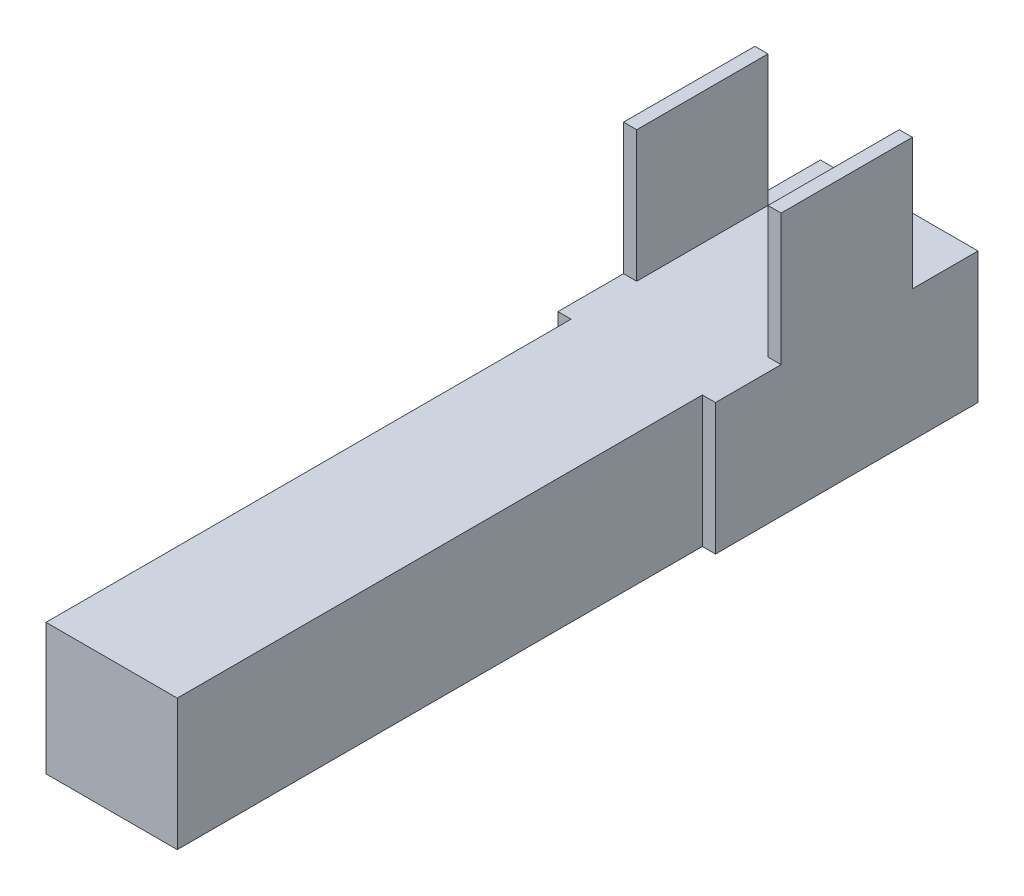
from build123d import *

# Parameters (mm, degrees)
SKETCH1_W           = 12.7
SKETCH1_H           = 152.4
BOSS_EXTRUDE1_DEPTH = 25.4
SKETCH6_W           = 50.8
SKETCH6_H           = 25.4
BOSS_EXTRUDE5_DEPTH = 2.54
SKETCH7_W           = 2.54
SKETCH7_H           = 25.4
BOSS_EXTRUDE6_DEPTH = 25.4


with BuildPart() as part:
    # Sketch1 → Boss-Extrude1 (new body)
    with BuildSketch(Plane(origin=(0, 0, 0), x_dir=(1, 0, 0), z_dir=(0, 1, 0))):
        with Locations((6.35, 76.2)):
            Rectangle(SKETCH1_W, SKETCH1_H)
    boss_extrude1 = extrude(amount=BOSS_EXTRUDE1_DEPTH)

    # Sketch6 → Boss-Extrude5 (add)
    with BuildSketch(Plane(origin=(12.7, 0, 0), x_dir=(0, 0, -1), z_dir=(1, 0, 0))):
        with Locations((127, 12.7)):
            Rectangle(SKETCH6_W, SKETCH6_H)
    boss_extrude5 = extrude(amount=BOSS_EXTRUDE5_DEPTH)

    # Sketch7 → Boss-Extrude6 (add)
    with BuildSketch(Plane(origin=(0, 25.4, 0), x_dir=(1, 0, 0), z_dir=(0, 1, 0))):
        with Locations((13.97, 127)):
            Rectangle(SKETCH7_W, SKETCH7_H)
    boss_extrude6 = extrude(amount=BOSS_EXTRUDE6_DEPTH)

    # Mirror1: Boss-Extrude1, Boss-Extrude5, Boss-Extrude6 across plane
    add(boss_extrude1.mirror(Plane(origin=(0, 25.4, 0), x_dir=(0, 0, 1), z_dir=(1, 0, 0))))
    add(boss_extrude5.mirror(Plane(origin=(0, 25.4, 0), x_dir=(0, 0, 1), z_dir=(1, 0, 0))))
    add(boss_extrude6.mirror(Plane(origin=(0, 25.4, 0), x_dir=(0, 0, 1), z_dir=(1, 0, 0))))


solid = part.part
